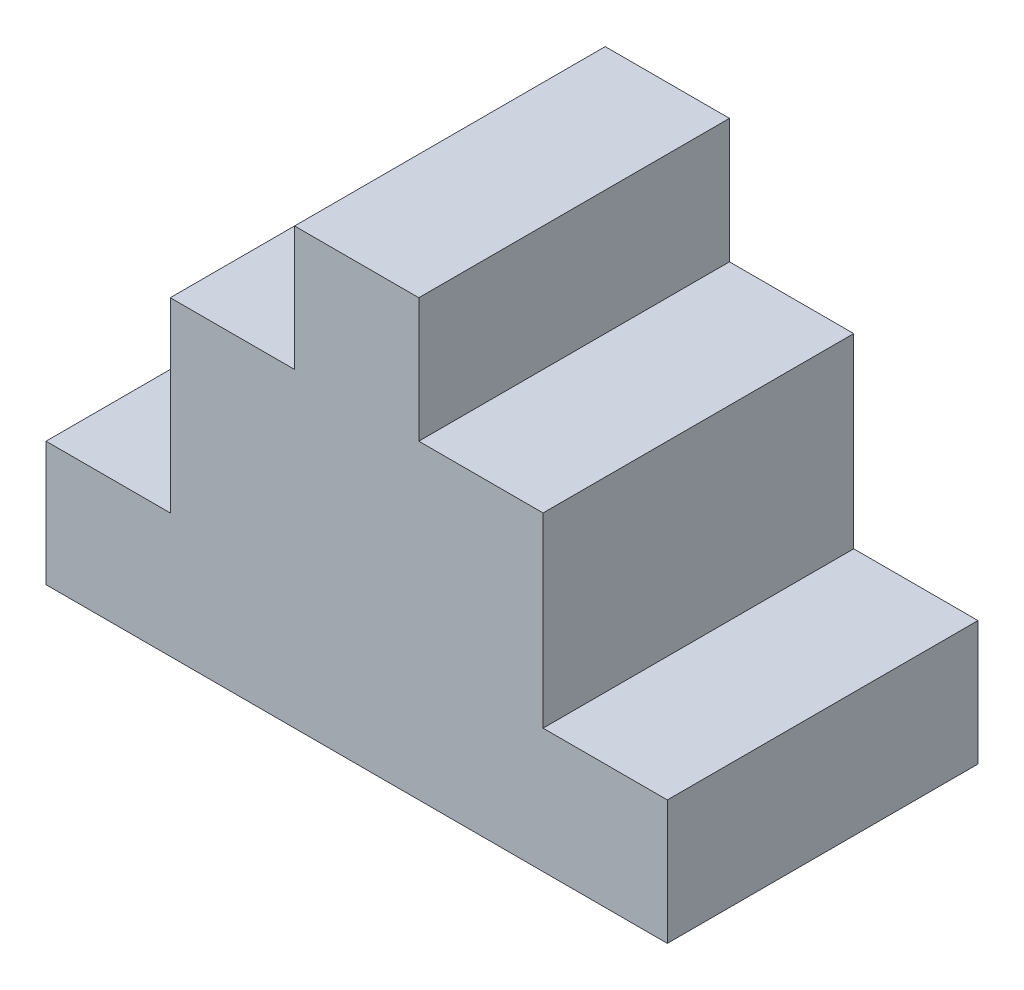
from build123d import *

# Parameters (mm, degrees)
BOSS_EXTRUDE1_DEPTH = 2.5


with BuildPart() as part:
    # Sketch1 → Boss-Extrude1 (new, symmetric)
    with BuildSketch(Plane.XY):
        Polygon((-1, 7), (1, 7), (1, 5), (3, 5), (3, 2), (5, 2), (5, 0), (-5, 0), (-5, 2), (-3, 2), (-3, 5), (-1, 5), align=None)
    extrude(amount=BOSS_EXTRUDE1_DEPTH, both=True)


solid = part.part
